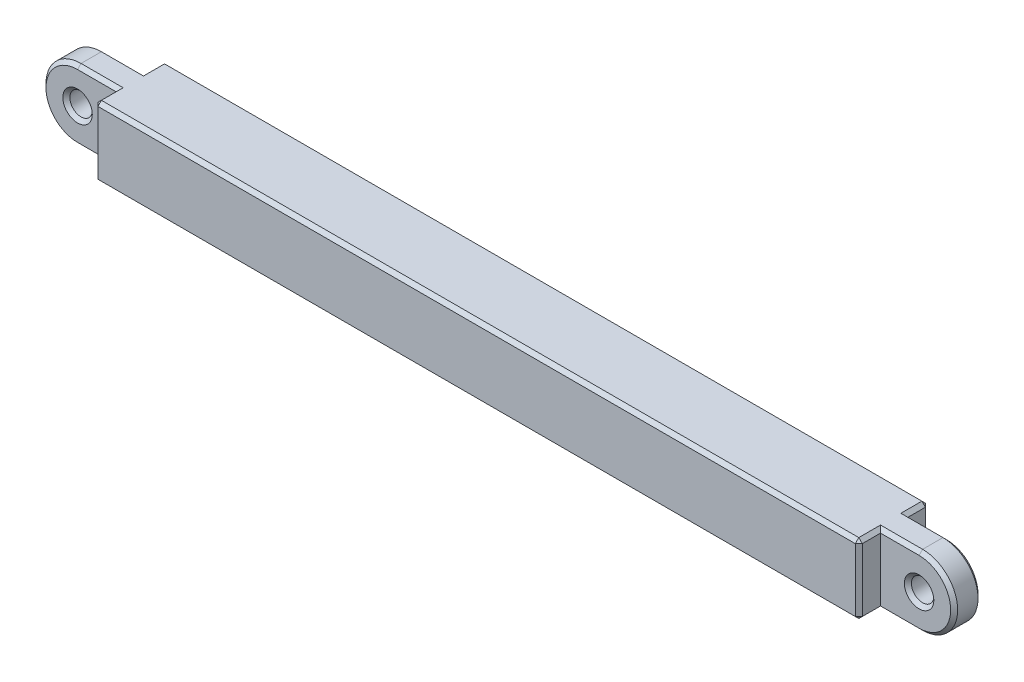
from build123d import *

# Parameters (mm, degrees)
BOSS_EXTRUDE1_DEPTH      = 1.95
BOSS_EXTRUDE1_DEPTH_BACK = 1.95
SKETCH1_R                = 1.6
BOSS_EXTRUDE2_DEPTH      = 3.1
BOSS_EXTRUDE2_DEPTH_BACK = 6.9
SKETCH2_W                = 109
SKETCH2_H                = 10
CHAMFER1_SIZE            = 0.5


with BuildPart() as part:
    # Sketch1 → Boss-Extrude1 (new, two sides: drawn at the far end of the back side and taken through both)
    with BuildSketch(Plane.XY.offset(-BOSS_EXTRUDE1_DEPTH_BACK)):
        with BuildLine():
            Line((0, 5), (120, 5))
            ThreePointArc((120, 5), (125, 0), (120, -5))
            Line((120, -5), (0, -5))
            ThreePointArc((0, -5), (-5, 0), (0, 5))
        make_face()
        Circle(SKETCH1_R, mode=Mode.SUBTRACT)
        with Locations((120, 0)):
            Circle(SKETCH1_R, mode=Mode.SUBTRACT)
    extrude(amount=BOSS_EXTRUDE1_DEPTH + BOSS_EXTRUDE1_DEPTH_BACK)

    # Sketch2 → Boss-Extrude2 (add, two sides: drawn at the far end of the back side and taken through both)
    with BuildSketch(Plane.XY.offset(1.95).offset(-BOSS_EXTRUDE2_DEPTH_BACK)):
        with Locations((60, 0)):
            Rectangle(SKETCH2_W, SKETCH2_H)
    extrude(amount=BOSS_EXTRUDE2_DEPTH + BOSS_EXTRUDE2_DEPTH_BACK)

    # Chamfer1
    chamfer1_edges = [part.edges().sort_by_distance(p)[0] for p in [
        (125, 0, -1.95),
        (-5, 0, -1.95),
        (2.75, 5, -1.95),
        (5.5, 5, -3.45),
        (117.25, 5, -1.95),
        (114.5, 5, -3.45),
        (114.5, 0, -4.95),
        (60, 5, -4.95),
        (5.5, 0, -4.95),
        (117.25, -5, -1.95),
        (114.5, -5, -3.45),
        (60, -5, -4.95),
        (5.5, -5, -3.45),
        (2.75, -5, -1.95),
        (-5, 0, 1.95),
        (125, 0, 1.95),
        (117.25, 5, 1.95),
        (114.5, 5, 3.5),
        (2.75, 5, 1.95),
        (5.5, 5, 3.5),
        (2.75, -5, 1.95),
        (5.5, -5, 3.5),
        (117.25, -5, 1.95),
        (114.5, -5, 3.5),
        (60, 5, 5.05),
        (114.5, 0, 5.05),
        (60, -5, 5.05),
        (5.5, 0, 5.05),
        (118.4, 0, 1.95),
        (118.4, 0, -1.95),
        (-1.6, 0, 1.95),
        (-1.6, 0, -1.95),
    ]]
    chamfer(chamfer1_edges, length=CHAMFER1_SIZE)


solid = part.part
